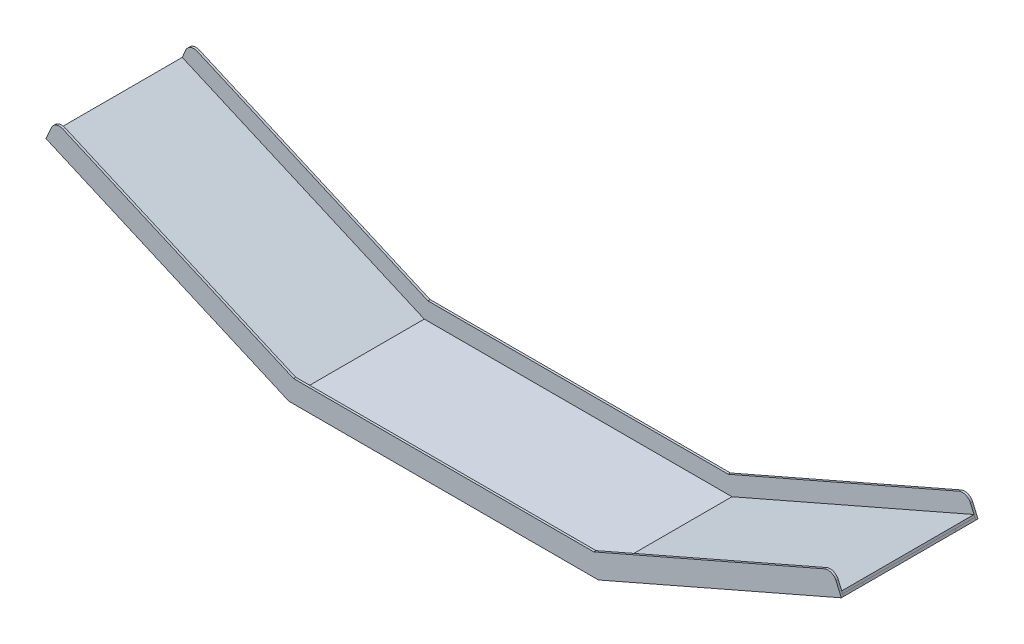
from build123d import *

# Parameters (mm, degrees)
BOSS_EXTRU_1_DEPTH   = 150
BOSS_EXTRU_2_DEPTH   = 22.5
BOSS_EXTRU_3_DEPTH   = 22.5
BOSS_EXTRU_4_DEPTH   = 105
BOSS_EXTRU_4_2_DEPTH = 105
BOSS_EXTRU_5_DEPTH   = 2.5
BOSS_EXTRU_6_DEPTH   = 2.5
CONG_1_R             = 10
CONG_2_R             = 10
CONG_3_R             = 10
CONG_4_R             = 10


with BuildPart() as part:
    # Esquisse1 → Boss.-Extru.1 (new body)
    with BuildSketch(Plane.XY):
        Polygon((0, 0), (-275, -120), (-625, -120), (-900, 0), (-899.00013886, 2.291348446), (-624.478298671, -117.5), (-275.521701329, -117.5), (-0.99986114, 2.291348446), align=None)
    extrude(amount=BOSS_EXTRU_1_DEPTH)


with BuildPart() as body_2:
    # Esquisse2 → Boss.-Extru.2 (new body)
    with BuildSketch(Plane(origin=(0, 0, 0), x_dir=(-1, 0, 0), z_dir=(0, 0, -1))):
        Polygon((0, 0), (275, -120), (625, -120), (900, 0), (900.99986114, -2.291348446), (625.521701329, -122.5), (274.478298671, -122.5), (-0.99986114, -2.291348446), align=None)
    extrude(amount=-BOSS_EXTRU_2_DEPTH)


with BuildPart() as body_3:
    # Esquisse3 → Boss.-Extru.3 (new body)
    with BuildSketch(Plane.XY.offset(150)):
        Polygon((-900, 0), (-900.99986114, -2.291348446), (-625.521701329, -122.5), (-274.478298671, -122.5), (0.99986114, -2.291348446), (0, 0), (-275, -120), (-625, -120), align=None)
    extrude(amount=-BOSS_EXTRU_3_DEPTH)


with BuildPart() as body_4:
    # Esquisse4 → Boss.-Extru.4 (new body)
    with BuildSketch(Plane(origin=(0, 0, 127.5), x_dir=(-1, 0, 0), z_dir=(0, 0, -1))):
        Polygon((900.99986114, -2.291348446), (900, 0), (877.086515541, -9.9986114), (878.086376681, -12.289959846), align=None)
    extrude(amount=BOSS_EXTRU_4_DEPTH)


with BuildPart() as body_5:
    # Esquisse4 → Boss.-Extru.4 2 (new body)
    with BuildSketch(Plane(origin=(0, 0, 127.5), x_dir=(-1, 0, 0), z_dir=(0, 0, -1))):
        Polygon((-0.99986114, -2.291348446), (0, 0), (22.913484459, -9.9986114), (21.913623319, -12.289959846), align=None)
    extrude(amount=BOSS_EXTRU_4_2_DEPTH)


with BuildPart() as body_6:
    # Esquisse5 → Boss.-Extru.5 (new body)
    with BuildSketch(Plane.XY.offset(150)):
        Polygon((0.99986114, -2.291348446), (-8.99875026, 20.622136013), (-279.695311958, -97.5), (-620.304688042, -97.5), (-891.00124974, 20.622136013), (-900.99986114, -2.291348446), (-625.521701329, -122.5), (-274.478298671, -122.5), align=None)
    extrude(amount=BOSS_EXTRU_5_DEPTH)

    # Congé2
    cong_2_edges = [body_6.edges().sort_by_distance(p)[0] for p in [
        (-891.00124974, 20.622136013, 151.25),
    ]]
    fillet(cong_2_edges, radius=CONG_2_R)

    # Congé3
    cong_3_edges = [body_6.edges().sort_by_distance(p)[0] for p in [
        (-8.99875026, 20.622136013, 151.25),
    ]]
    fillet(cong_3_edges, radius=CONG_3_R)


with BuildPart() as body_7:
    # Esquisse6 → Boss.-Extru.6 (new body)
    with BuildSketch(Plane(origin=(0, 0, 0), x_dir=(-1, 0, 0), z_dir=(0, 0, -1))):
        Polygon((8.99875026, 20.622136013), (-0.99986114, -2.291348446), (274.478298671, -122.5), (625.521701329, -122.5), (900.99986114, -2.291348446), (891.00124974, 20.622136013), (620.304688042, -97.5), (279.695311958, -97.5), align=None)
    extrude(amount=BOSS_EXTRU_6_DEPTH)

    # Congé1
    cong_1_edges = [body_7.edges().sort_by_distance(p)[0] for p in [
        (-891.00124974, 20.622136013, -1.25),
    ]]
    fillet(cong_1_edges, radius=CONG_1_R)

    # Congé4
    cong_4_edges = [body_7.edges().sort_by_distance(p)[0] for p in [
        (-8.99875026, 20.622136013, -1.25),
    ]]
    fillet(cong_4_edges, radius=CONG_4_R)


solid = Compound([part.part, body_2.part, body_3.part, body_4.part, body_5.part, body_6.part, body_7.part])
